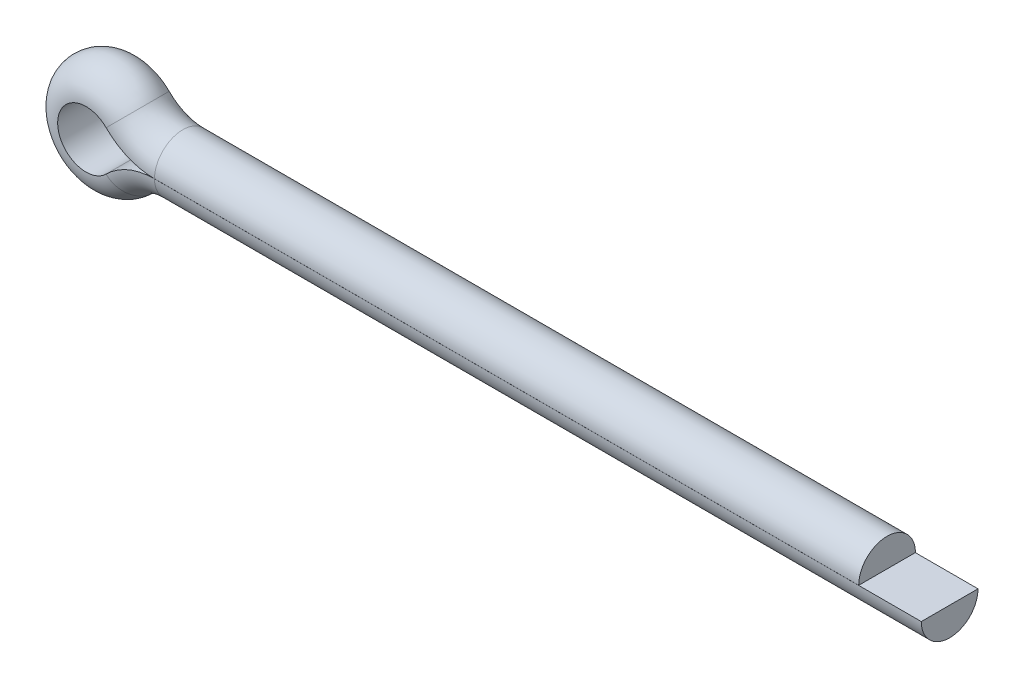
from build123d import *


with BuildPart() as part:
    # Body: sweep along a path in PathSke
    with BuildLine(Plane.XY) as body_path:
        Line((36, 1.45), (0, 1.45))
        ThreePointArc((0, 1.45), (-0.784287723, 1.606029633), (-1.449137781, 2.050357081))
        ThreePointArc((-1.449137781, 2.050357081), (-6.4, 0), (-1.449137781, -2.050357081))
        ThreePointArc((-1.449137781, -2.050357081), (-0.784287723, -1.606029633), (0, -1.45))
        Line((0, -1.45), (39.2, -1.45))
    # SectionSke → Body (sweep)
    with BuildSketch(Plane(origin=(36, 0, 0), x_dir=(0, 0, -1), z_dir=(1, 0, 0))):
        with BuildLine():
            Line((-1.449998621, 0.002), (1.449998621, 0.002))
            ThreePointArc((1.449998621, 0.002), (0, 1.45), (-1.449998621, 0.002))
        make_face()
    sweep(path=body_path.line)


solid = part.part
